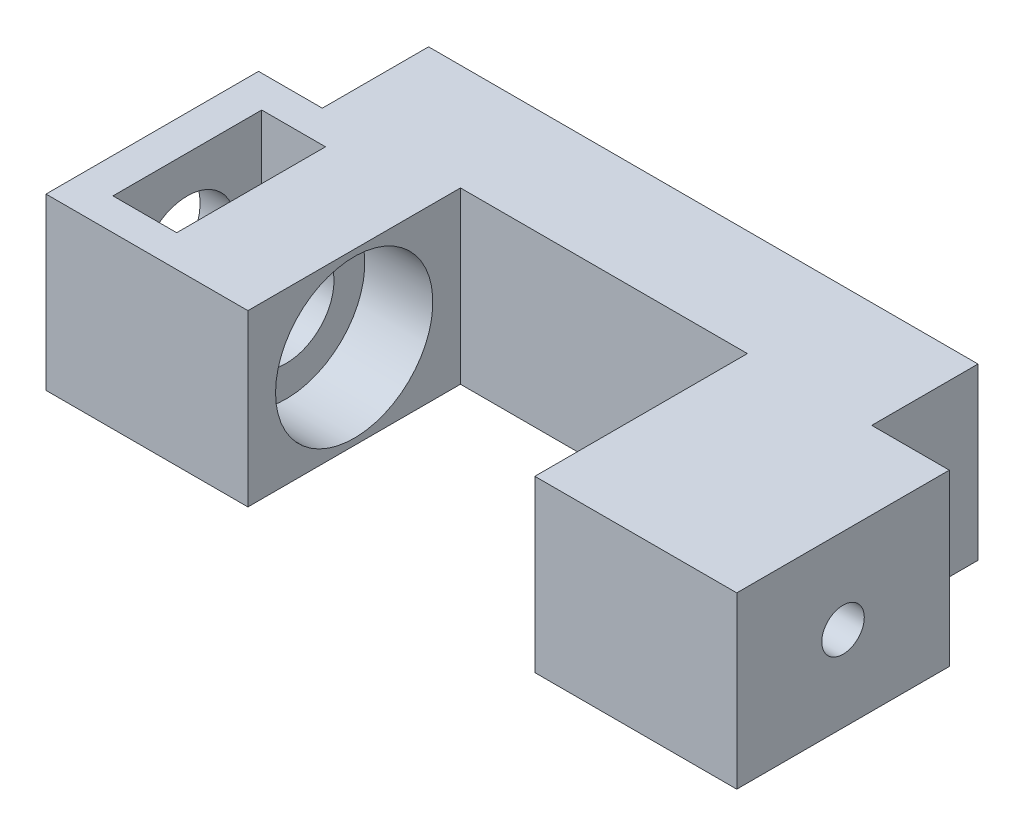
from build123d import *

# Parameters (mm, degrees)
SHAPE_DEPTH                   = 4
SHAPE_DEPTH_BACK              = 4
ESQUISSE19_R                  = 2.25
HOLEAXE_MOTOR_DEPTH           = 13
ESQUISSE20_R                  = 3.7
HOLEBEARING_MOTOR_DEPTH       = 3.2
ESQUISSE21_R                  = 2.2
ENTRETOISEBEARING_MOTOR_DEPTH = 1
EXT_MOTOR_START               = 3
ESQUISSE22_W                  = 10
ESQUISSE22_H                  = 8
ESQUISSE22_R                  = 2.25
EXT_MOTOR_DEPTH               = 3
ESQUISSE23_W                  = 3
ESQUISSE23_H                  = 7
HOLESCREWLESS_MOTOR_DEPTH     = 10
ESQUISSE24_W                  = 10
ESQUISSE24_H                  = 8
BOSS_EXTRU_1_DEPTH            = 3
ESQUISSE25_W                  = 5
ESQUISSE25_H                  = 8
ADJUSTMENT_ATTACH_DEPTH       = 0.65
ESQUISSE26_R                  = 1
REMOVE_HELPER_DEPTH           = 10


with BuildPart() as part:
    # Esquisse17 → Shape (new, two sides: drawn at the far end of the back side and taken through both)
    with BuildSketch(Plane(origin=(0, 40, 0), x_dir=(-1, 0, 0), z_dir=(0, -1, 0)).offset(-SHAPE_DEPTH_BACK)):
        Polygon((13.25, 105), (13.25, 95), (6.75, 95), (6.75, 105), (-6.75, 105), (-6.75, 95), (-13.25, 95), (-13.25, 105), (-13.25, 110), (13.25, 110), align=None)
    extrude(amount=SHAPE_DEPTH + SHAPE_DEPTH_BACK)

    # Esquisse19 → HoleAxe_motor (cut)
    with BuildSketch(Plane.ZY.offset(13.25)):
        with Locations((-100, 40)):
            Circle(ESQUISSE19_R)
    extrude(amount=-HOLEAXE_MOTOR_DEPTH, mode=Mode.SUBTRACT)

    # Esquisse20 → HoleBearing_motor (cut)
    with BuildSketch(Plane.ZY.offset(-6.75)):
        with Locations((-100, 40)):
            Circle(ESQUISSE20_R)
    holebearing_motor = extrude(amount=-HOLEBEARING_MOTOR_DEPTH, mode=Mode.SUBTRACT)

    # Symétrie3: HoleBearing_motor across plane
    add(holebearing_motor.mirror(Plane(origin=(0, 0, 0), x_dir=(0, 0, 1), z_dir=(1, 0, 0))), mode=Mode.SUBTRACT)

    # Esquisse21 → entretoiseBearing_motor (cut)
    with BuildSketch(Plane.ZY.offset(-9.95)):
        with Locations((-100, 40)):
            Circle(ESQUISSE21_R)
    extrude(amount=-ENTRETOISEBEARING_MOTOR_DEPTH, mode=Mode.SUBTRACT)

    # Esquisse22 → Ext_motor (add)
    with BuildSketch(Plane.ZY.offset(13.25).offset(EXT_MOTOR_START)):
        with Locations((-100, 40)):
            Rectangle(ESQUISSE22_W, ESQUISSE22_H)
        with Locations((-100, 40)):
            Circle(ESQUISSE22_R, mode=Mode.SUBTRACT)
    extrude(amount=-EXT_MOTOR_DEPTH)

    # Esquisse23 → HoleScrewLess_motor (cut)
    with BuildSketch(Plane(origin=(0, 44, 0), x_dir=(1, 0, 0), z_dir=(0, 1, 0))):
        with Locations((-13.1, 100)):
            Rectangle(ESQUISSE23_W, ESQUISSE23_H)
    extrude(amount=-HOLESCREWLESS_MOTOR_DEPTH, mode=Mode.SUBTRACT)

    # Esquisse24 → Boss.-Extru.1 (add)
    with BuildSketch(Plane(origin=(13.25, 0, 0), x_dir=(0, 0, -1), z_dir=(1, 0, 0))):
        with Locations((100, 40)):
            Rectangle(ESQUISSE24_W, ESQUISSE24_H)
    extrude(amount=BOSS_EXTRU_1_DEPTH)

    # Esquisse25 → Adjustment attach (cut)
    with BuildSketch(Plane(origin=(13.25, 0, 0), x_dir=(0, 0, -1), z_dir=(1, 0, 0))):
        with Locations((107.5, 40)):
            Rectangle(ESQUISSE25_W, ESQUISSE25_H)
    extrude(amount=-ADJUSTMENT_ATTACH_DEPTH, mode=Mode.SUBTRACT)

    # Esquisse26 → Remove helper (cut)
    with BuildSketch(Plane.ZY.offset(-10.95)):
        with Locations((-100, 40)):
            Circle(ESQUISSE26_R)
    extrude(amount=-REMOVE_HELPER_DEPTH, mode=Mode.SUBTRACT)


solid = part.part
